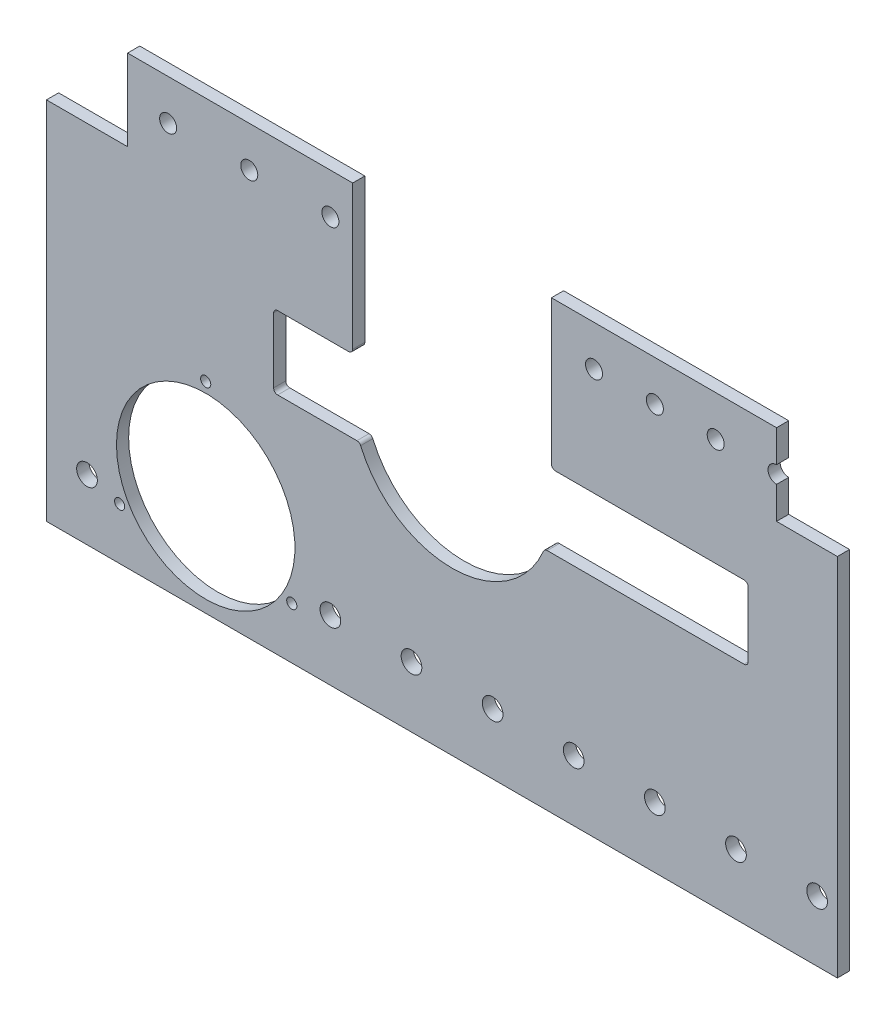
from build123d import *

# Parameters (mm, degrees)
SKETCH_1_W                = 100
SKETCH_1_H                = 130
EXTRUDE_1_DEPTH           = 3
SKETCH_2_R                = 2.1
CUT_EXTRUDE_1_DEPTH       = 83.060952956
SKETCH_5_W                = 100
SKETCH_5_H                = 130
EXTRUDE_2_DEPTH           = 3
CUT_EXTRUDE_4_DEPTH       = 164.505351594
CUT_EXTRUDE_4_DEPTH_BACK  = 164.505351594
SKETCH_6_R                = 2.1
CUT_EXTRUDE_5_DEPTH       = 164.505351594
CUT_EXTRUDE_5_DEPTH_BACK  = 164.505351594
SKETCH_7_R                = 2.55
CUT_EXTRUDE_6_DEPTH       = 164.505351594
CUT_EXTRUDE_6_DEPTH_BACK  = 164.505351594
CUT_EXTRUDE_7_DEPTH       = 164.505351594
CUT_EXTRUDE_7_DEPTH_BACK  = 164.505351594
SKETCH_12_W               = 20
SKETCH_12_H               = 20
CUT_EXTRUDE_8_DEPTH       = 164.505351594
CUT_EXTRUDE_8_DEPTH_BACK  = 164.505351594
SKETCH_13_W               = 200
SKETCH_13_H               = 20
CUT_EXTRUDE_9_DEPTH       = 164.505351594
CUT_EXTRUDE_9_DEPTH_BACK  = 164.505351594
SKETCH_14_W               = 5
SKETCH_14_H               = 90
CUT_EXTRUDE_10_DEPTH      = 159.930802553
CUT_EXTRUDE_10_DEPTH_BACK = 159.930802553
SKETCH_15_R               = 1.25
SKETCH_15_R_2             = 22
CUT_EXTRUDE_11_DEPTH      = 159.930802553
CUT_EXTRUDE_11_DEPTH_BACK = 159.930802553
FILLET_1_R                = 1


with BuildPart() as part:
    # 草图1 → 凸台-拉伸1 (new body)
    with BuildSketch(Plane.XY):
        Rectangle(SKETCH_1_W, SKETCH_1_H)
    extrude(amount=EXTRUDE_1_DEPTH)

    # 草图2 → 切除-拉伸1 (cut, through all)
    with BuildSketch(Plane.XY.offset(3)):
        with Locations((-40, 55)):
            Circle(SKETCH_2_R)
        with Locations((-20, 55)):
            Circle(SKETCH_2_R)
        with Locations((0, 55)):
            Circle(SKETCH_2_R)
        with Locations((20, 55)):
            Circle(SKETCH_2_R)
        with Locations((40, 55)):
            Circle(SKETCH_2_R)
        with Locations((-40, -55)):
            Circle(SKETCH_2_R)
        with Locations(Location((40, -55, 0), (0, 0, 180))):
            Circle(SKETCH_2_R)
        with Locations(Location((20, -55, 0), (0, 0, 180))):
            Circle(SKETCH_2_R)
        with Locations(Location((0, -55, 0), (0, 0, 180))):
            Circle(SKETCH_2_R)
        with Locations(Location((-20, -55, 0), (0, 0, 180))):
            Circle(SKETCH_2_R)
    extrude(amount=-CUT_EXTRUDE_1_DEPTH, mode=Mode.SUBTRACT)

    # 草图5 → 凸台-拉伸2 (add)
    with BuildSketch(Plane.XY.offset(3)):
        with Locations((100, 0)):
            Rectangle(SKETCH_5_W, SKETCH_5_H)
    extrude(amount=-EXTRUDE_2_DEPTH)

    # 草图6 → 切除-拉伸4 (cut, two sides: drawn at the far end of the back side and taken through both)
    with BuildSketch(Plane.XY.offset(3).offset(-CUT_EXTRUDE_4_DEPTH_BACK)):
        with Locations((55, 55)):
            Circle(SKETCH_6_R)
        with Locations((70, 55)):
            Circle(SKETCH_6_R)
        with Locations((85, 55)):
            Circle(SKETCH_6_R)
        with Locations((100, 55)):
            Circle(SKETCH_6_R)
        with Locations((115, 55)):
            Circle(SKETCH_6_R)
        with Locations((130, 55)):
            Circle(SKETCH_6_R)
        with Locations((145, 55)):
            Circle(SKETCH_6_R)
        with Locations((145, -55)):
            Circle(SKETCH_6_R)
        with Locations((130, -55)):
            Circle(SKETCH_6_R)
        with Locations((115, -55)):
            Circle(SKETCH_6_R)
        with Locations((100, -55)):
            Circle(SKETCH_6_R)
        with Locations((85, -55)):
            Circle(SKETCH_6_R)
        with Locations((70, -55)):
            Circle(SKETCH_6_R)
        with Locations((55, -55)):
            Circle(SKETCH_6_R)
    extrude(amount=CUT_EXTRUDE_4_DEPTH + CUT_EXTRUDE_4_DEPTH_BACK, mode=Mode.SUBTRACT)

    # 草图7 → 切除-拉伸5 (cut, two sides: drawn at the far end of the back side and taken through both)
    with BuildSketch(Plane(origin=(0, 0, 0), x_dir=(-1, 0, 0), z_dir=(0, 0, -1)).offset(-CUT_EXTRUDE_5_DEPTH_BACK)):
        with Locations((-140, -30)):
            Circle(SKETCH_7_R)
        with Locations((-120, -30)):
            Circle(SKETCH_7_R)
        with Locations((-100, -30)):
            Circle(SKETCH_7_R)
        with Locations((-80, -30)):
            Circle(SKETCH_7_R)
        with Locations((-60, -30)):
            Circle(SKETCH_7_R)
        with Locations((-40, -30)):
            Circle(SKETCH_7_R)
        with Locations((-20, -30)):
            Circle(SKETCH_7_R)
        with Locations((0, -30)):
            Circle(SKETCH_7_R)
        with Locations((20, -30)):
            Circle(SKETCH_7_R)
        with Locations((40, -30)):
            Circle(SKETCH_7_R)
    extrude(amount=CUT_EXTRUDE_5_DEPTH + CUT_EXTRUDE_5_DEPTH_BACK, mode=Mode.SUBTRACT)

    # 草图11 → 切除-拉伸6 (cut, two sides: drawn at the far end of the back side and taken through both)
    with BuildSketch(Plane.XY.offset(3).offset(-CUT_EXTRUDE_6_DEPTH_BACK)):
        with BuildLine():
            Line((74.5, 19.5), (74.5, 65))
            Line((74.5, 65), (25.5, 65))
            Line((25.5, 65), (25.5, 19.5))
            ThreePointArc((25.5, 19.5), (50, -5), (74.5, 19.5))
        make_face()
    extrude(amount=CUT_EXTRUDE_6_DEPTH + CUT_EXTRUDE_6_DEPTH_BACK, mode=Mode.SUBTRACT)

    # 草图12 → 切除-拉伸7 (cut, two sides: drawn at the far end of the back side and taken through both)
    with BuildSketch(Plane.XY.offset(3).offset(-CUT_EXTRUDE_7_DEPTH_BACK)):
        with Locations((-40, 55)):
            Rectangle(SKETCH_12_W, SKETCH_12_H)
        with Locations((140, 55)):
            Rectangle(SKETCH_12_W, SKETCH_12_H)
    extrude(amount=CUT_EXTRUDE_7_DEPTH + CUT_EXTRUDE_7_DEPTH_BACK, mode=Mode.SUBTRACT)

    # 草图13 → 切除-拉伸8 (cut, two sides: drawn at the far end of the back side and taken through both)
    with BuildSketch(Plane.XY.offset(3).offset(-CUT_EXTRUDE_8_DEPTH_BACK)):
        with Locations((50, -55)):
            Rectangle(SKETCH_13_W, SKETCH_13_H)
    extrude(amount=CUT_EXTRUDE_8_DEPTH + CUT_EXTRUDE_8_DEPTH_BACK, mode=Mode.SUBTRACT)

    # 草图14 → 切除-拉伸9 (cut, two sides: drawn at the far end of the back side and taken through both)
    with BuildSketch(Plane.XY.offset(3).offset(-CUT_EXTRUDE_9_DEPTH_BACK)):
        with Locations((147.5, 0)):
            Rectangle(SKETCH_14_W, SKETCH_14_H)
    extrude(amount=CUT_EXTRUDE_9_DEPTH + CUT_EXTRUDE_9_DEPTH_BACK, mode=Mode.SUBTRACT)

    # 草图15 → 切除-拉伸10 (cut, two sides: drawn at the far end of the back side and taken through both)
    with BuildSketch(Plane(origin=(0, 0, 0), x_dir=(-1, 0, 0), z_dir=(0, 0, -1)).offset(-CUT_EXTRUDE_10_DEPTH_BACK)):
        with Locations((10.74, 4.505)):
            Circle(SKETCH_15_R)
        with Locations((31.96195252, -32.2525)):
            Circle(SKETCH_15_R)
        with Locations((-10.48195252, -32.2525)):
            Circle(SKETCH_15_R)
        with Locations((10.74, -20)):
            Circle(SKETCH_15_R_2)
    extrude(amount=CUT_EXTRUDE_10_DEPTH + CUT_EXTRUDE_10_DEPTH_BACK, mode=Mode.SUBTRACT)

    # 草图16 → 切除-拉伸11 (cut, two sides: drawn at the far end of the back side and taken through both)
    with BuildSketch(Plane.XY.offset(3).offset(-CUT_EXTRUDE_11_DEPTH_BACK)):
        Polygon((6, 10.5), (6, 28.5), (25.5, 28.5), (74.5, 28.5), (123, 28.5), (123, 10.5), (74.5, 10.5), (25.5, 10.5), align=None)
    extrude(amount=CUT_EXTRUDE_11_DEPTH + CUT_EXTRUDE_11_DEPTH_BACK, mode=Mode.SUBTRACT)

    # 圆角1
    fillet_1_edges = [part.edges().sort_by_distance(p)[0] for p in [
        (74.5, 28.5, 1.5),
        (27.21294227, 10.5, 1.5),
        (72.78705773, 10.5, 1.5),
        (123, 10.5, 1.5),
        (25.5, 28.5, 1.5),
        (6, 28.5, 1.5),
        (6, 10.5, 1.5),
        (123, 28.5, 1.5),
    ]]
    fillet(fillet_1_edges, radius=FILLET_1_R)


solid = part.part
